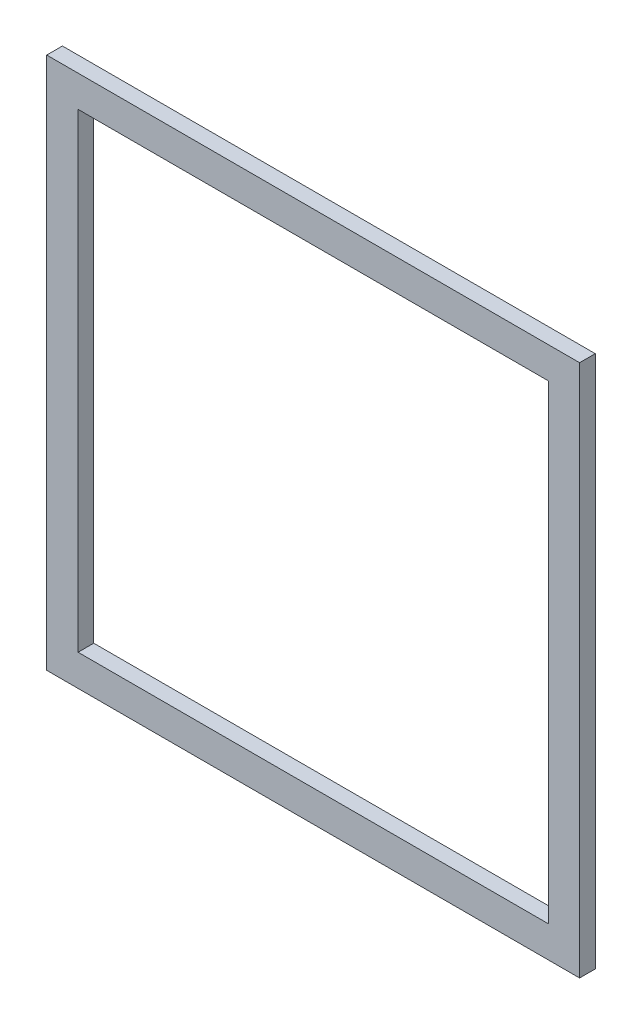
from build123d import *

# Parameters (mm, degrees)
ESQUISSE2_W        = 34
ESQUISSE2_H        = 34
ESQUISSE2_W_2      = 30
ESQUISSE2_H_2      = 30
BOSS_EXTRU_1_DEPTH = 1


with BuildPart() as part:
    # Esquisse2 → Boss.-Extru.1 (new body)
    with BuildSketch(Plane.XY):
        Rectangle(ESQUISSE2_W, ESQUISSE2_H)
        Rectangle(ESQUISSE2_W_2, ESQUISSE2_H_2, mode=Mode.SUBTRACT)
    extrude(amount=BOSS_EXTRU_1_DEPTH)


solid = part.part
